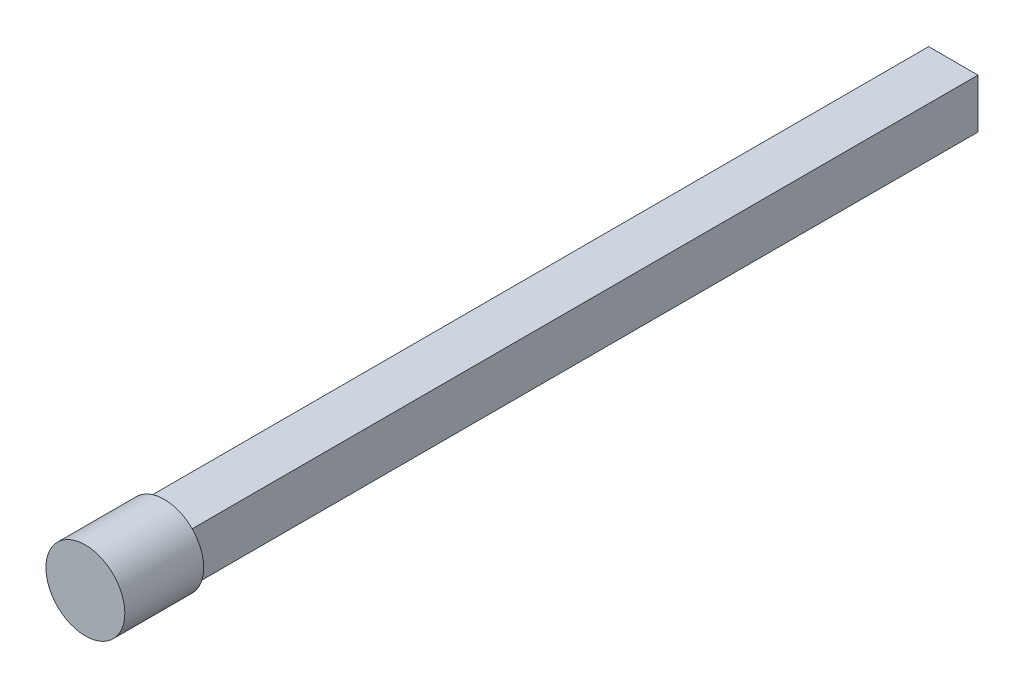
from build123d import *

# Parameters (mm, degrees)
SKETCH2_W           = 2.5
SKETCH2_H           = 2.5
BOSS_EXTRUDE1_DEPTH = 40
SKETCH3_R           = 2
BOSS_EXTRUDE2_DEPTH = 4


with BuildPart() as part:
    # Sketch2 → Boss-Extrude1 (new body)
    with BuildSketch(Plane.XY):
        with Locations((1.25, -1.25)):
            Rectangle(SKETCH2_W, SKETCH2_H)
    extrude(amount=BOSS_EXTRUDE1_DEPTH)

    # Sketch3 → Boss-Extrude2 (add)
    with BuildSketch(Plane.XY.offset(40)):
        with Locations((1.25, -1.25)):
            Circle(SKETCH3_R)
    extrude(amount=BOSS_EXTRUDE2_DEPTH)


solid = part.part
